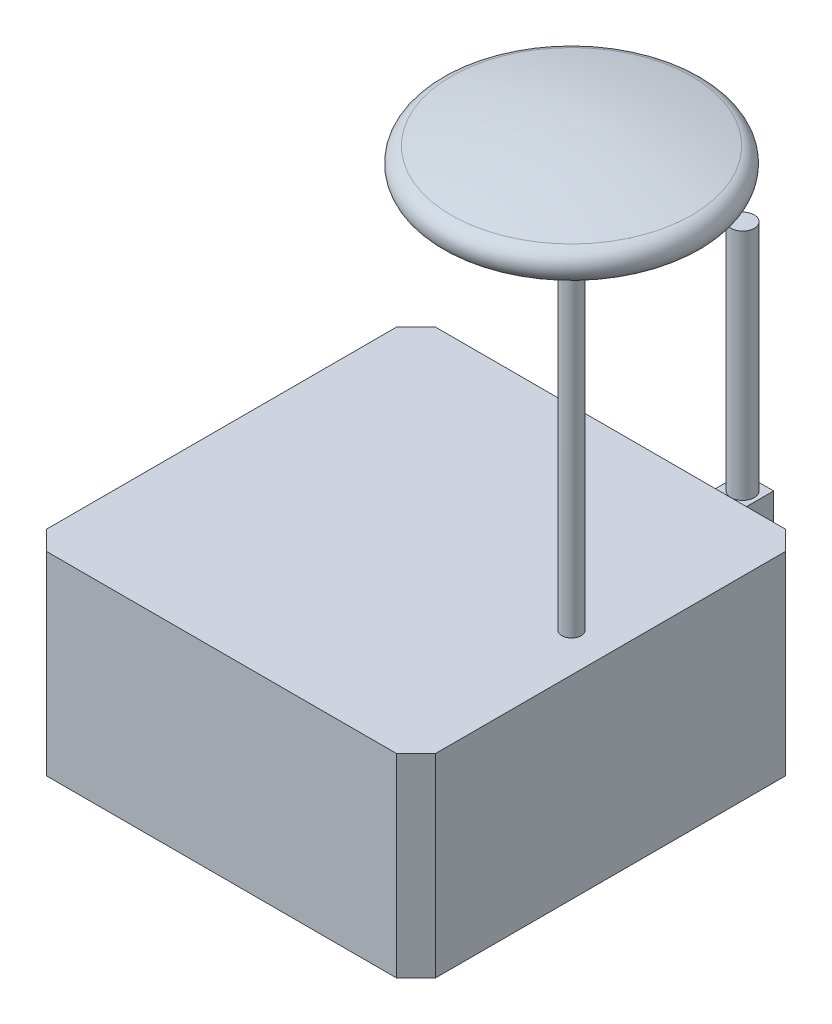
from build123d import *

# Parameters (mm, degrees)
EXTRUDE_1_DEPTH = 50
SKETCH_2_R      = 2.5
EXTRUDE_2_DEPTH = 100
SKETCH_5_R      = 2.5
EXTRUDE_3_DEPTH = 5
SKETCH_6_W      = 8
SKETCH_6_H      = 8
EXTRUDE_4_DEPTH = 8
SKETCH_7_R      = 3
EXTRUDE_5_DEPTH = 60


with BuildPart() as part:
    # 草圖1 → 填料-伸長1 (new body)
    with BuildSketch(Plane(origin=(0, 0, 0), x_dir=(1, 0, 0), z_dir=(0, 1, 0))):
        Polygon((-50, 45), (-50, -45), (-45, -50), (45, -50), (50, -45), (50, 45), (45, 50), (-45, 50), align=None)
    extrude(amount=EXTRUDE_1_DEPTH)

    # 草圖2 → 填料-伸長2 (add)
    with BuildSketch(Plane(origin=(0, 50, 0), x_dir=(1, 0, 0), z_dir=(0, 1, 0))):
        with Locations(Location((40, 0, 0), (0, 0, 90))):
            Circle(SKETCH_2_R)
    extrude(amount=EXTRUDE_2_DEPTH)

    # 草圖4 → 旋轉1 (revolve)
    with BuildSketch(Plane.XY, mode=Mode.PRIVATE) as revolve_1_sk:
        with BuildLine():
            Line((40, 150), (40, 161.880718379))
            add(Edge.make_bspline(
                [(40, 161.880718379), (49.36254318, 162.224748332), (61.644131944, 160.150653719), (70.94600245, 157.886525359)],
                knots=[0, 0, 0, 0, 1, 1, 1, 1], degree=3))
            ThreePointArc((70.94600245, 157.886525359), (73.971530022, 153.523608058), (70, 150))
            Line((70, 150), (40, 150))
        make_face()
    revolve(revolve_1_sk.sketch.rotate(Axis((40, 150, 0), (0, 1, 0)), 90), axis=Axis((40, 150, 0), (0, 1, 0)))

    # 草圖5 → 填料-伸長3 (add)
    with BuildSketch(Plane(origin=(0, 0, -50), x_dir=(-1, 0, 0), z_dir=(0, 0, -1))):
        with Locations(Location((-25, 40, 0), (0, 0, 180))):
            Circle(SKETCH_5_R)
    extrude(amount=EXTRUDE_3_DEPTH)

    # 草圖6 → 填料-伸長4 (add)
    with BuildSketch(Plane(origin=(0, 0, -55), x_dir=(-1, 0, 0), z_dir=(0, 0, -1))):
        with Locations((-25, 40)):
            Rectangle(SKETCH_6_W, SKETCH_6_H)
    extrude(amount=EXTRUDE_4_DEPTH)

    # 草圖7 → 填料-伸長5 (add)
    with BuildSketch(Plane(origin=(0, 44, 0), x_dir=(1, 0, 0), z_dir=(0, 1, 0))):
        with Locations(Location((25, 59, 0), (0, 0, 270))):
            Circle(SKETCH_7_R)
    extrude(amount=EXTRUDE_5_DEPTH)


solid = part.part
